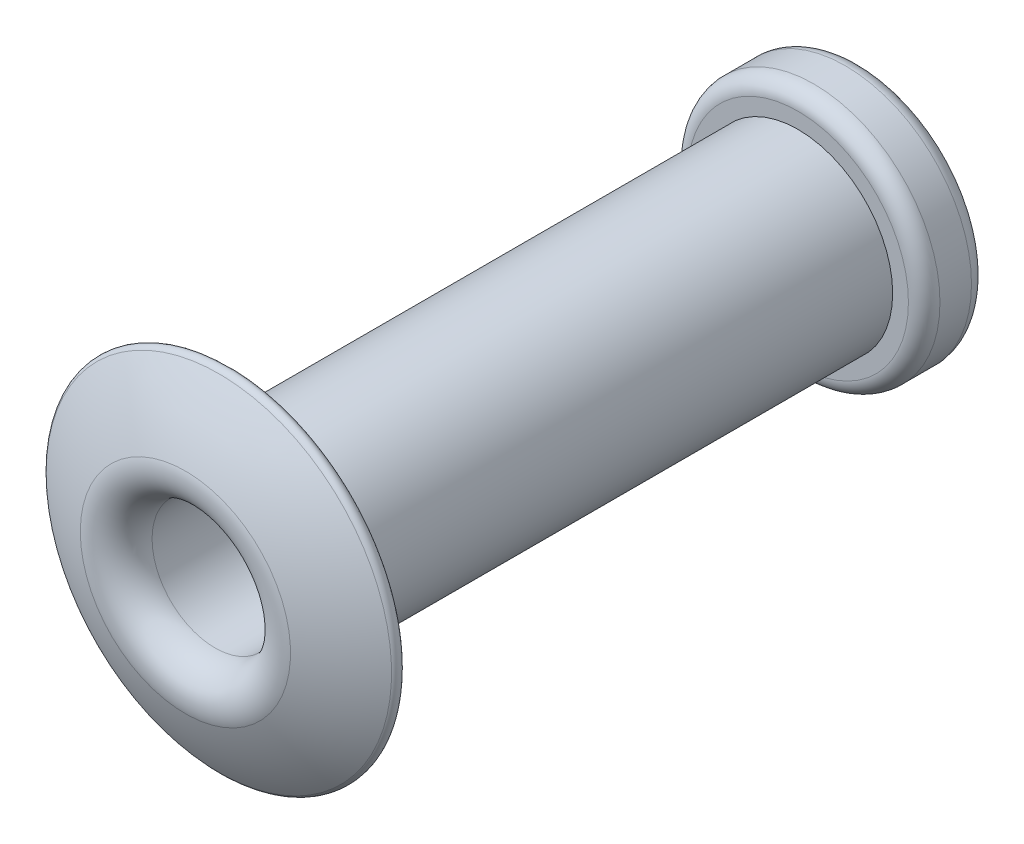
from build123d import *

# Parameters (mm, degrees)
SKETCH_2_R          = 1
CUT_EXTRUDE_1_DEPTH = 12.789826123
FILLET_1_R          = 0.25
FILLET_2_R          = 0.1
FILLET_3_R          = 0.5


with BuildPart() as part:
    # ｽｹｯﾁ1 → 回転1 (revolve)
    with BuildSketch(Plane(origin=(0, 0, 0), x_dir=(1, 0, 0), z_dir=(0, 1, 0))):
        with BuildLine():
            Line((0, -5.5), (0, 5.5))
            Line((0, 5.5), (2, 5.5))
            Line((2, 5.5), (2, 4.5))
            Line((2, 4.5), (1.5, 4.5))
            Line((1.5, 4.5), (1.5, -4.5))
            Line((1.5, -4.5), (3, -4.5))
            ThreePointArc((3, -4.5), (1.58113883, -5.24341649), (0, -5.5))
        make_face()
    revolve(axis=Axis((0, 0, 5.5), (0, 0, -1)))

    # ｽｹｯﾁ2 → ｶｯﾄ - 押し出し1 (cut, through all)
    with BuildSketch(Plane(origin=(0, 0, -5.5), x_dir=(-1, 0, 0), z_dir=(0, 0, -1))):
        Circle(SKETCH_2_R)
    extrude(amount=-CUT_EXTRUDE_1_DEPTH, mode=Mode.SUBTRACT)

    # ﾌｨﾚｯﾄ1
    fillet_1_edges = [part.edges().sort_by_distance(p)[0] for p in [
        (-2, 0, -4.5),
        (-2, 0, -5.5),
    ]]
    fillet(fillet_1_edges, radius=FILLET_1_R)

    # ﾌｨﾚｯﾄ2
    fillet_2_edges = [part.edges().sort_by_distance(p)[0] for p in [
        (-3, 0, 4.5),
    ]]
    fillet(fillet_2_edges, radius=FILLET_2_R)

    # ﾌｨﾚｯﾄ3
    fillet_3_edges = [part.edges().sort_by_distance(p)[0] for p in [
        (0, -1, 5.398979486),
        (1, 0, -5.5),
    ]]
    fillet(fillet_3_edges, radius=FILLET_3_R)


solid = part.part
